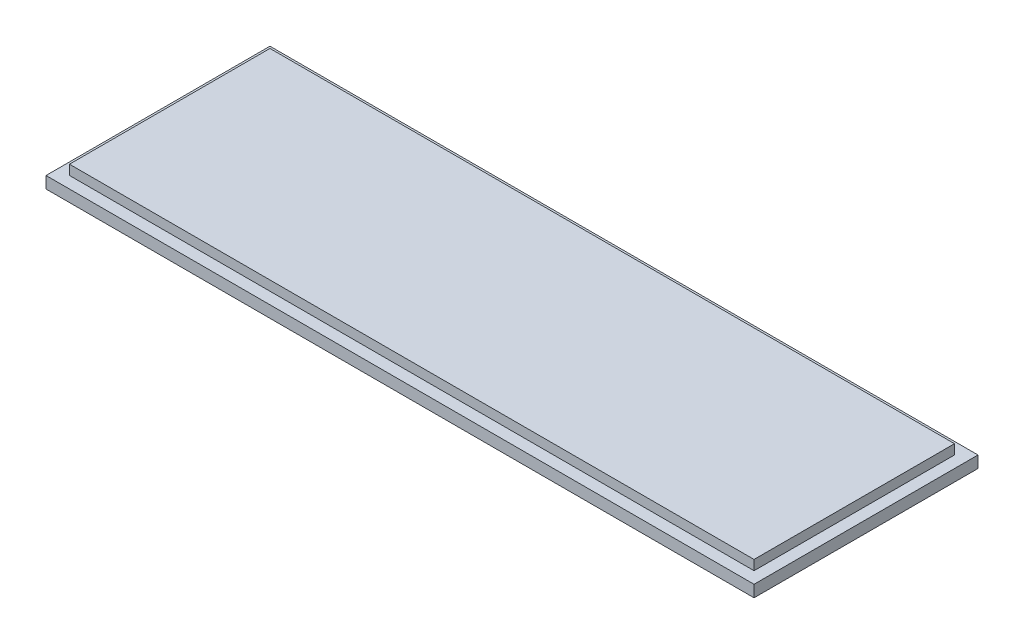
from build123d import *

# Parameters (mm, degrees)
SKICA1_W                = 72.4
SKICA1_H                = 22.9
P_IDAT_VYSUNUT_M2_DEPTH = 1.2
SKICA2_W                = 70
SKICA2_H                = 20.5
P_IDAT_VYSUNUT_M3_DEPTH = 1


with BuildPart() as part:
    # Skica1 → Přidat vysunutím2 (new body)
    with BuildSketch(Plane(origin=(0, 0, 0), x_dir=(1, 0, 0), z_dir=(0, 1, 0))):
        with Locations((36.2, 11.45)):
            Rectangle(SKICA1_W, SKICA1_H)
    extrude(amount=P_IDAT_VYSUNUT_M2_DEPTH)

    # Skica2 → Přidat vysunutím3 (add)
    with BuildSketch(Plane(origin=(0, 1.2, 0), x_dir=(1, 0, 0), z_dir=(0, 1, 0))):
        with Locations((36.2, 11.45)):
            Rectangle(SKICA2_W, SKICA2_H)
    extrude(amount=P_IDAT_VYSUNUT_M3_DEPTH)


solid = part.part
